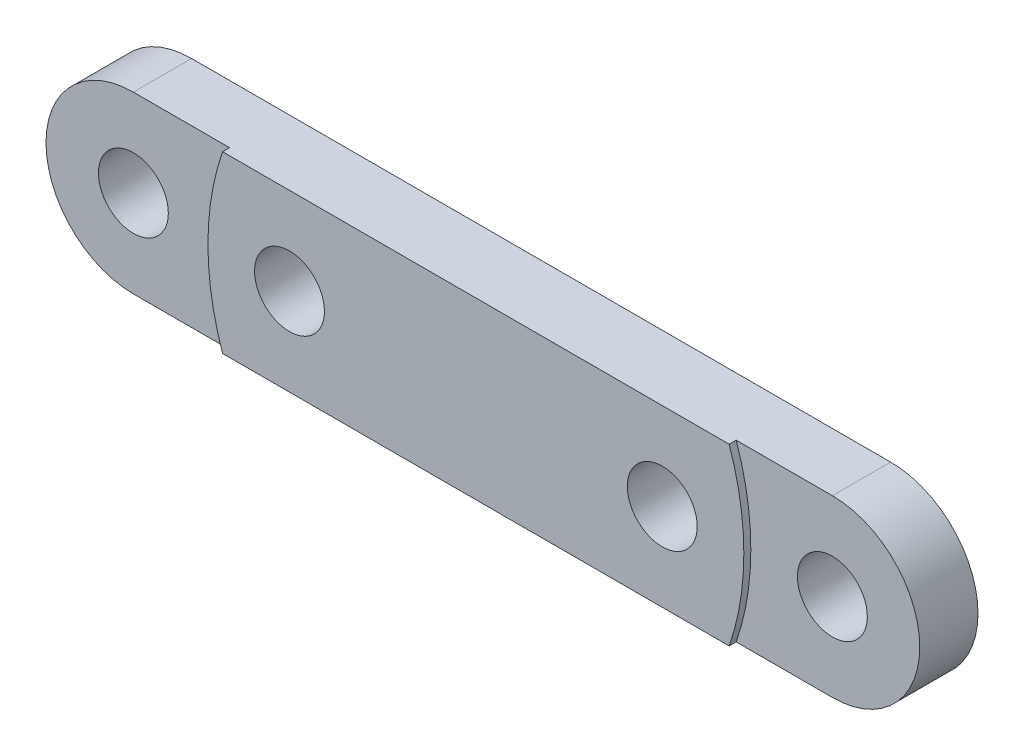
from build123d import *

# Parameters (mm, degrees)
SKIZZE1_R       = 1.5
BASE_DEPTH      = 2.5
SKIZZE3_W       = 21.742814906
SKIZZE3_H       = 7.5
SKIZZE3_R       = 1.5
DISTANCER_DEPTH = 0.3


with BuildPart() as part:
    # Skizze1 → Base (new body)
    with BuildSketch(Plane.XY):
        with BuildLine():
            Line((-15, 3.75), (15, 3.75))
            ThreePointArc((15, 3.75), (18.75, 0), (15, -3.75))
            Line((15, -3.75), (-15, -3.75))
            ThreePointArc((-15, -3.75), (-18.75, 0), (-15, 3.75))
        make_face()
        with Locations((-15, 0)):
            Circle(SKIZZE1_R, mode=Mode.SUBTRACT)
        with Locations((15, 0)):
            Circle(SKIZZE1_R, mode=Mode.SUBTRACT)
        with Locations((-8, 0)):
            Circle(SKIZZE1_R, mode=Mode.SUBTRACT)
        with Locations((8, 0)):
            Circle(SKIZZE1_R, mode=Mode.SUBTRACT)
    extrude(amount=BASE_DEPTH)

    # Skizze3 → Distancer (add)
    # profile 1 of 3: a face of its own
    with BuildSketch(Plane.XY.offset(2.5)):
        with BuildLine():
            ThreePointArc((-10.871407453, 3.75), (-11.5, 0), (-10.871407453, -3.75))
            Line((-10.871407453, -3.75), (-10.871407453, 3.75))
        make_face()
    # profile 2 of 3: a face of its own
    with BuildSketch(Plane.XY.offset(2.5)):
        with BuildLine():
            Line((10.871407453, 3.75), (10.871407453, -3.75))
            ThreePointArc((10.871407453, -3.75), (11.341763216, -1.901159422), (11.5, 0))
            ThreePointArc((11.5, 0), (11.341763216, 1.901159422), (10.871407453, 3.75))
        make_face()
    # profile 3 of 3: a face of its own
    with BuildSketch(Plane.XY.offset(2.5)):
        Rectangle(SKIZZE3_W, SKIZZE3_H)
        with Locations((-8, 0)):
            Circle(SKIZZE3_R, mode=Mode.SUBTRACT)
        with Locations((8, 0)):
            Circle(SKIZZE3_R, mode=Mode.SUBTRACT)
    extrude(amount=DISTANCER_DEPTH)


solid = part.part
